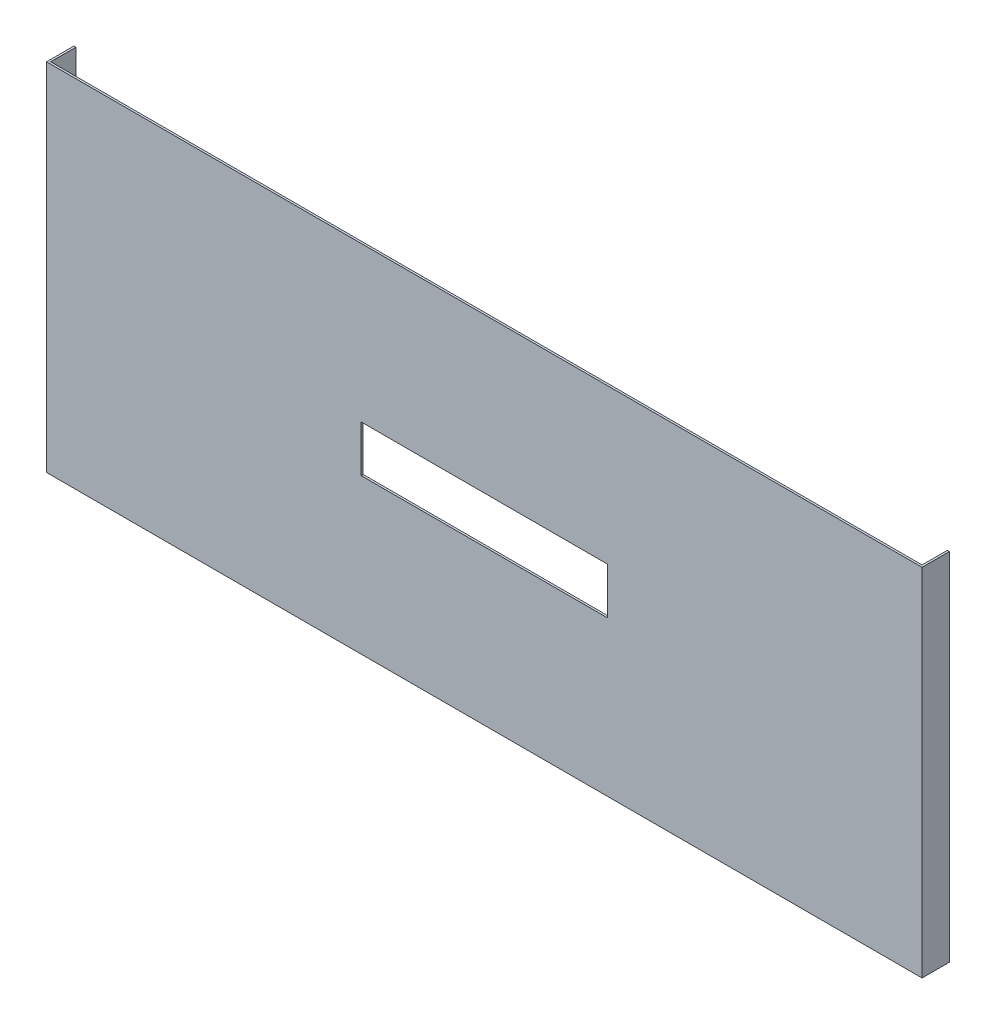
from build123d import *

# Parameters (mm, degrees)
TOPPING_KLAPE_ALT2_KAPAK_1_START = 200
TOPPING_KLAPE_ALT2_KAPAK_1_DEPTH = 260
TOPPING_KLAPE_ALT2_KAPAK_2_START = 27
SKETCH2_W                        = 180
SKETCH2_H                        = 34
TOPPING_KLAPE_ALT2_KAPAK_2_DEPTH = 14


with BuildPart() as part:
    # Sketch1 → TOPPING_klape_alt2_kapak_1 (new body)
    with BuildSketch(Plane(origin=(0, 0, 0), x_dir=(1, 0, 0), z_dir=(0, 1, 0)).offset(TOPPING_KLAPE_ALT2_KAPAK_1_START)):
        Polygon((30, -40), (30, -20), (31.5, -20), (31.5, -38.5), (668.5, -38.5), (668.5, -20), (670, -20), (670, -40), align=None)
    extrude(amount=TOPPING_KLAPE_ALT2_KAPAK_1_DEPTH)

    # Sketch2 → TOPPING_klape_alt2_kapak_2 (cut)
    with BuildSketch(Plane.XY.offset(TOPPING_KLAPE_ALT2_KAPAK_2_START)):
        with Locations((350, 330)):
            Rectangle(SKETCH2_W, SKETCH2_H)
    extrude(amount=TOPPING_KLAPE_ALT2_KAPAK_2_DEPTH, mode=Mode.SUBTRACT)


solid = part.part
